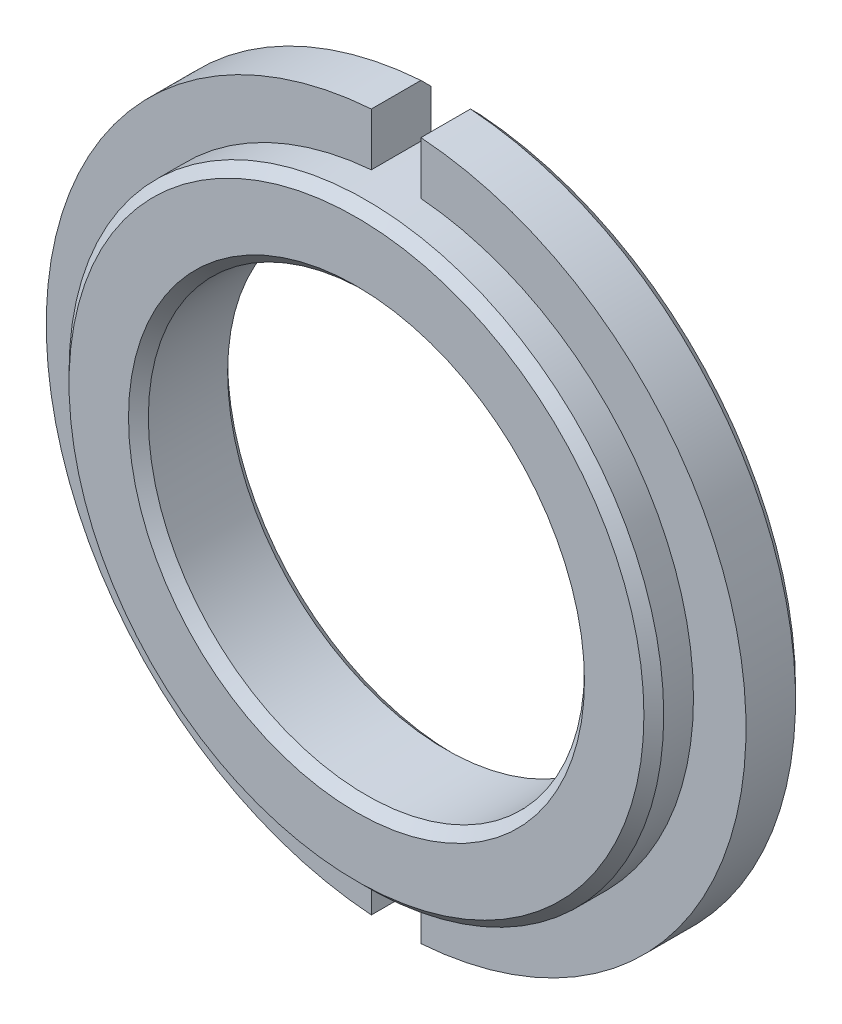
from build123d import *

# Parameters (mm, degrees)
SKETCH1_R           = 17.65
SKETCH1_R_2         = 11
BOSS_EXTRUDE1_DEPTH = 5
CUT_EXTRUDE1_START  = -2
SKETCH2_R           = 17.65
SKETCH2_R_2         = 15
CUT_EXTRUDE1_DEPTH  = 2
CUT_EXTRUDE3_REACH  = 27.141
CHAMFER1_SIZE       = 0.5


with BuildPart() as part:
    # Sketch1 → Boss-Extrude1 (new body)
    with BuildSketch(Plane.XY):
        Circle(SKETCH1_R)
        Circle(SKETCH1_R_2, mode=Mode.SUBTRACT)
    extrude(amount=BOSS_EXTRUDE1_DEPTH)

    # Sketch2 → Cut-Extrude1 (cut)
    with BuildSketch(Plane.XY.offset(5).offset(CUT_EXTRUDE1_START)):
        Circle(SKETCH2_R)
        Circle(SKETCH2_R_2, mode=Mode.SUBTRACT)
    extrude(amount=CUT_EXTRUDE1_DEPTH, mode=Mode.SUBTRACT)

    # Sketch3 → Cut-Extrude3 (cut, up to next)
    with BuildSketch(Plane.XY.offset(3), mode=Mode.PRIVATE) as cut_extrude3_sk1:
        with BuildLine():
            Line((1.25, 17.605680901), (1.25, 14.947825929))
            ThreePointArc((1.25, 14.947825929), (0, 15), (-1.25, 14.947825929))
            Line((-1.25, 14.947825929), (-1.25, 17.605680901))
            ThreePointArc((-1.25, 17.605680901), (0, 17.65), (1.25, 17.605680901))
        make_face()
    cut_extrude3_tool1 = extrude(cut_extrude3_sk1.sketch, amount=-CUT_EXTRUDE3_REACH, mode=Mode.PRIVATE) & part.part
    # Sketch3 → Cut-Extrude3 (cut, up to next)
    with BuildSketch(Plane.XY.offset(3), mode=Mode.PRIVATE) as cut_extrude3_sk2:
        with BuildLine():
            Line((1.25, -14.947825929), (1.25, -17.605680901))
            ThreePointArc((1.25, -17.605680901), (0, -17.65), (-1.25, -17.605680901))
            Line((-1.25, -17.605680901), (-1.25, -14.947825929))
            ThreePointArc((-1.25, -14.947825929), (0, -15), (1.25, -14.947825929))
        make_face()
    cut_extrude3_tool2 = extrude(cut_extrude3_sk2.sketch, amount=-CUT_EXTRUDE3_REACH, mode=Mode.PRIVATE) & part.part
    add(cut_extrude3_tool1.solids().sort_by_distance((0, 16.308915, 3))[0], mode=Mode.SUBTRACT)
    add(cut_extrude3_tool2.solids().sort_by_distance((0, -16.308915, 3))[0], mode=Mode.SUBTRACT)

    # Chamfer1
    chamfer1_edges = [part.edges().sort_by_distance(p)[0] for p in [
        (-15, 0, 5),
        (-17.65, 0, 0),
        (17.65, 0, 0),
        (-11, 0, 0),
        (-11, 0, 5),
    ]]
    chamfer(chamfer1_edges, length=CHAMFER1_SIZE)


solid = part.part
